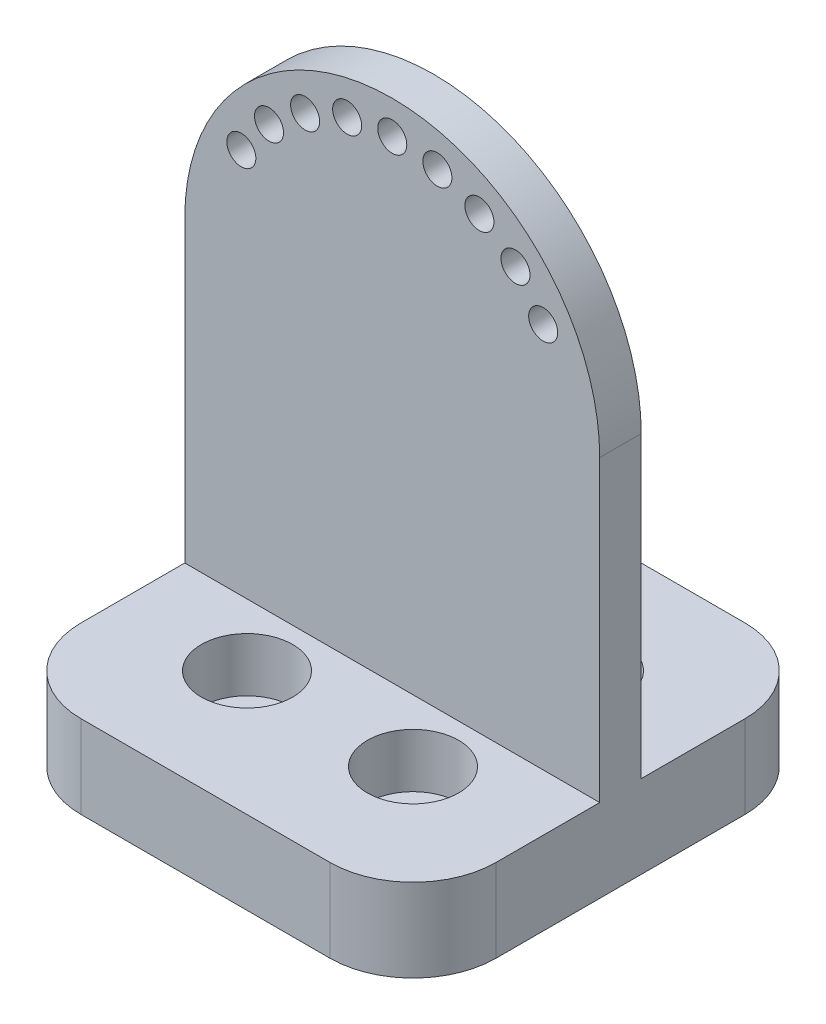
from build123d import *

# Parameters (mm, degrees)
SKETCH_1_W               = 50
SKETCH_1_H               = 50
EXTRUDE_1_DEPTH          = 10
EXTRUDE_2_DEPTH          = 2.5
CUT_EXTRUDE_1_DEPTH      = 80.315824398
CUT_EXTRUDE_1_DEPTH_BACK = 80.315824398
SKETCH_5_R               = 1.75
CUT_EXTRUDE_3_DEPTH      = 80.315824398
CUT_EXTRUDE_3_DEPTH_BACK = 5
SKETCH_6_R               = 3.3
FILLET_1_R               = 10
SKETCH_8_R               = 5.5
CUT_EXTRUDE_5_DEPTH      = 6.5


with BuildPart() as part:
    # ｽｹｯﾁ1 → ﾎﾞｽ - 押し出し1 (new body)
    with BuildSketch(Plane(origin=(0, 0, 0), x_dir=(1, 0, 0), z_dir=(0, 1, 0))):
        Rectangle(SKETCH_1_W, SKETCH_1_H)
    extrude(amount=EXTRUDE_1_DEPTH)

    # ｽｹｯﾁ2 → ﾎﾞｽ - 押し出し2 (add, symmetric)
    with BuildSketch(Plane.XY):
        with BuildLine():
            Line((25, 46), (25, 10))
            Line((25, 10), (-25, 10))
            Line((-25, 10), (-25, 46))
            ThreePointArc((-25, 46), (0, 71), (25, 46))
        make_face()
    extrude(amount=EXTRUDE_2_DEPTH, both=True)

    # ｽｹｯﾁ5 → ｶｯﾄ - 押し出し1 (cut, two sides: drawn at the far end of the back side and taken through both)
    with BuildSketch(Plane.XY.offset(-CUT_EXTRUDE_1_DEPTH_BACK)):
        with Locations((0, 67)):
            Circle(SKETCH_5_R)
        with Locations((5.435199947, 66.284442352)):
            Circle(SKETCH_5_R)
        with Locations((10.5, 64.186533479)):
            Circle(SKETCH_5_R)
        with Locations((14.849242405, 60.849242405)):
            Circle(SKETCH_5_R)
        with Locations((18.186533479, 56.5)):
            Circle(SKETCH_5_R)
        with Locations((-18.186533479, 56.5)):
            Circle(SKETCH_5_R)
        with Locations((-14.849242405, 60.849242405)):
            Circle(SKETCH_5_R)
        with Locations((-10.5, 64.186533479)):
            Circle(SKETCH_5_R)
        with Locations((-5.435199947, 66.284442352)):
            Circle(SKETCH_5_R)
    extrude(amount=CUT_EXTRUDE_1_DEPTH + CUT_EXTRUDE_1_DEPTH_BACK, mode=Mode.SUBTRACT)

    # ｽｹｯﾁ6 → ｶｯﾄ - 押し出し3 (cut, two sides: drawn at the far end of the back side and taken through both)
    with BuildSketch(Plane(origin=(0, 0, 0), x_dir=(1, 0, 0), z_dir=(0, 1, 0)).offset(-CUT_EXTRUDE_3_DEPTH_BACK)):
        with Locations(Location((-10, -10, 0), (0, 0, 90))):
            Circle(SKETCH_6_R)
        with Locations(Location((10, -10, 0), (0, 0, 90))):
            Circle(SKETCH_6_R)
        with Locations(Location((10, 10, 0), (0, 0, 90))):
            Circle(SKETCH_6_R)
        with Locations(Location((-10, 10, 0), (0, 0, 90))):
            Circle(SKETCH_6_R)
    extrude(amount=CUT_EXTRUDE_3_DEPTH + CUT_EXTRUDE_3_DEPTH_BACK, mode=Mode.SUBTRACT)

    # ﾌｨﾚｯﾄ1
    fillet_1_edges = [part.edges().sort_by_distance(p)[0] for p in [
        (-25, 5, 25),
        (-25, 5, -25),
        (25, 5, -25),
        (25, 5, 25),
    ]]
    fillet(fillet_1_edges, radius=FILLET_1_R)

    # ｽｹｯﾁ8 → ｶｯﾄ - 押し出し5 (cut)
    with BuildSketch(Plane(origin=(0, 10, 0), x_dir=(1, 0, 0), z_dir=(0, 1, 0))):
        with Locations(Location((-10, -10, 0), (0, 0, 270))):
            Circle(SKETCH_8_R)
        with Locations(Location((10, -10, 0), (0, 0, 270))):
            Circle(SKETCH_8_R)
        with Locations(Location((10, 10, 0), (0, 0, 270))):
            Circle(SKETCH_8_R)
        with Locations(Location((-10, 10, 0), (0, 0, 270))):
            Circle(SKETCH_8_R)
    extrude(amount=-CUT_EXTRUDE_5_DEPTH, mode=Mode.SUBTRACT)


solid = part.part
